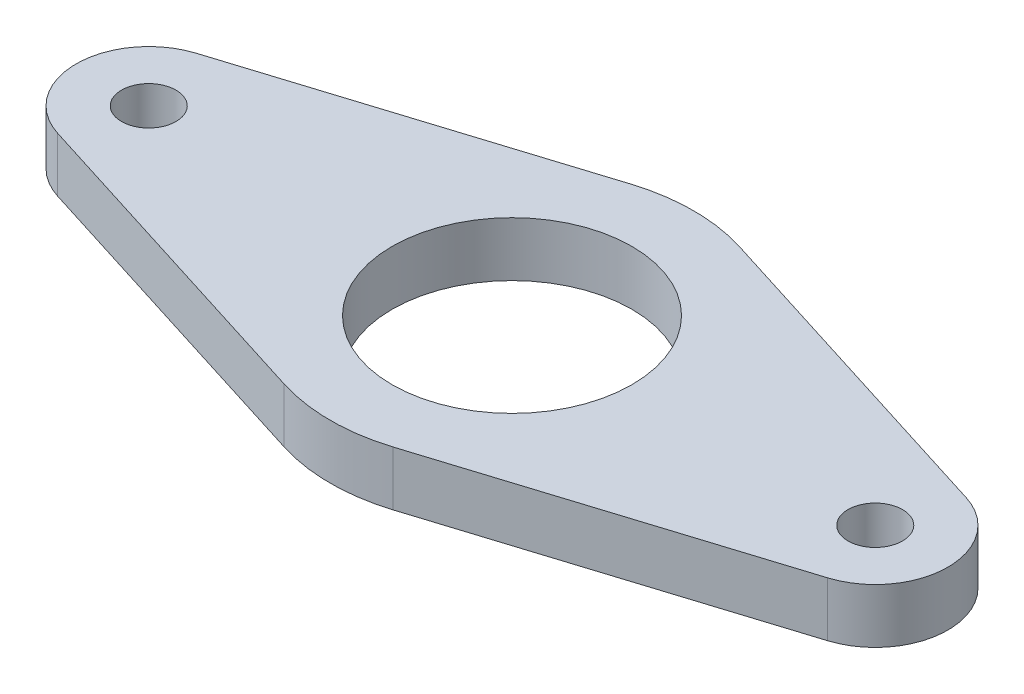
from build123d import *

# Parameters (mm, degrees)
SKETCH_1_R      = 1.5
SKETCH_1_R_2    = 6.6
EXTRUDE_1_DEPTH = 3


with BuildPart() as part:
    # 草图1 → 凸台-拉伸1 (new body)
    with BuildSketch(Plane(origin=(0, 0, 0), x_dir=(1, 0, 0), z_dir=(0, 1, 0))):
        with BuildLine():
            ThreePointArc((21.2, -3.815756806), (24, 0), (21.2, 3.815756806))
            Line((21.2, 3.815756806), (3, 9.539392014))
            ThreePointArc((3, 9.539392014), (0, 10), (-3, 9.539392014))
            Line((-3, 9.539392014), (-21.2, 3.815756806))
            ThreePointArc((-21.2, 3.815756806), (-24, 0), (-21.2, -3.815756806))
            Line((-21.2, -3.815756806), (-3, -9.539392014))
            ThreePointArc((-3, -9.539392014), (0, -10), (3, -9.539392014))
            Line((3, -9.539392014), (21.2, -3.815756806))
        make_face()
        with Locations((-20, 0)):
            Circle(SKETCH_1_R, mode=Mode.SUBTRACT)
        Circle(SKETCH_1_R_2, mode=Mode.SUBTRACT)
        with Locations((20, 0)):
            Circle(SKETCH_1_R, mode=Mode.SUBTRACT)
    extrude(amount=EXTRUDE_1_DEPTH)


solid = part.part
